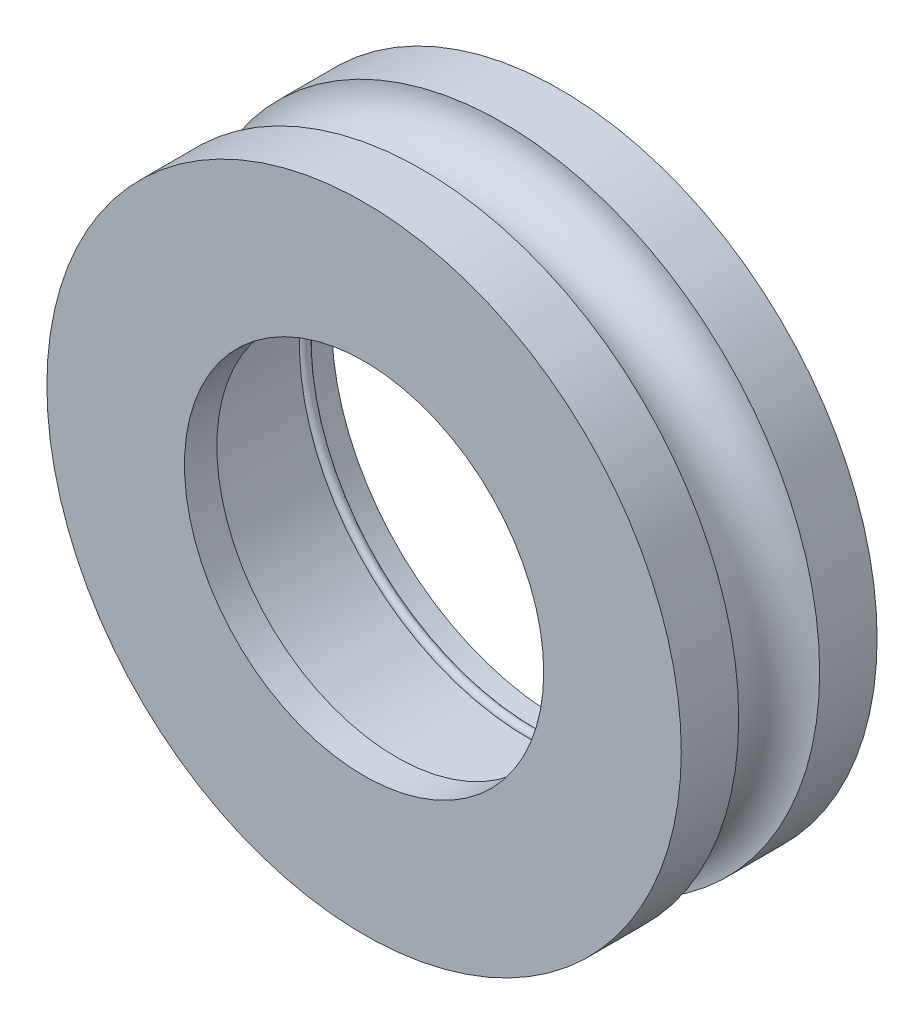
from build123d import *

# Parameters (mm, degrees)
CROQUIS1_R              = 14.1
CROQUIS1_R_2            = 11.1
SALIENTE_EXTRUIR1_DEPTH = 2
CORTAR_EXTRUIR1_DEPTH   = 1


with BuildPart() as part:
    # Croquis1 → Saliente-Extruir1 (new body)
    with BuildSketch(Plane.XY):
        Circle(CROQUIS1_R)
        Circle(CROQUIS1_R_2, mode=Mode.SUBTRACT)
    extrude(amount=SALIENTE_EXTRUIR1_DEPTH)

    # Croquis4 → Revolución1 (revolve)
    with BuildSketch(Plane(origin=(0, 0, 0), x_dir=(1, 0, 0), z_dir=(0, 1, 0))):
        with BuildLine():
            Line((14.1, -2), (14.1, 0))
            Line((14.1, 0), (14.1, 8.1))
            ThreePointArc((14.1, 8.1), (13.8, 8.4), (14.1, 8.7))
            Line((14.1, 8.7), (14.1, 10.1))
            Line((14.1, 10.1), (19.6, 10.1))
            Line((19.6, 10.1), (19.6, 6.55))
            ThreePointArc((19.6, 6.55), (17.1, 4.05), (19.6, 1.55))
            Line((19.6, 1.55), (19.6, -2))
            Line((19.6, -2), (14.1, -2))
        make_face()
    revolve(axis=Axis((0, 0, 0), (0, 0, -1)))

    # Croquis7 → Cortar-Extruir1 (cut)
    with BuildSketch(Plane(origin=(0, 0, -10.1), x_dir=(-1, 0, 0), z_dir=(0, 0, -1))):
        Polygon((14.592528054, 6.692949192), (16.092528054, 9.291025404), (13.092528054, 9.291025404), align=None)
        Polygon((1.5, 15.983974596), (0, 18.582050808), (-1.5, 15.983974596), align=None)
        Polygon((13.092528054, -9.291025404), (16.092528054, -9.291025404), (14.592528054, -6.692949192), align=None)
        Polygon((-1.5, -15.983974596), (0, -18.582050808), (1.5, -15.983974596), align=None)
        Polygon((-14.592528054, -6.692949192), (-16.092528054, -9.291025404), (-13.092528054, -9.291025404), align=None)
        Polygon((-13.092528054, 9.291025404), (-16.092528054, 9.291025404), (-14.592528054, 6.692949192), align=None)
    extrude(amount=-CORTAR_EXTRUIR1_DEPTH, mode=Mode.SUBTRACT)


solid = part.part
